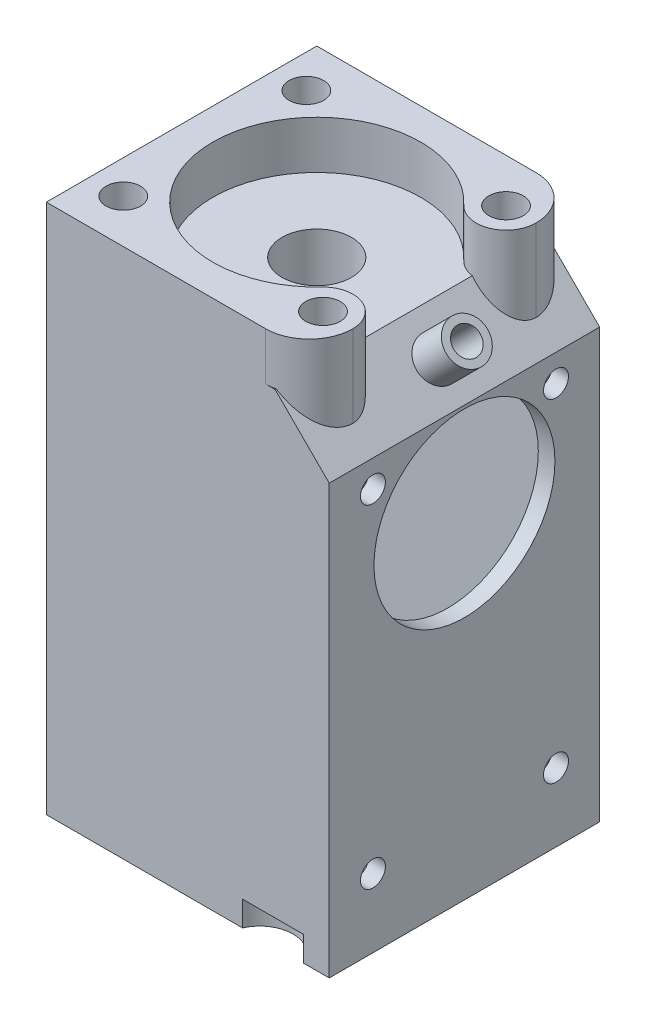
from build123d import *

# Parameters (mm, degrees)
SKETCH1_W           = 28.5
SKETCH1_H           = 46.5
SKETCH1_R           = 1.5
SKETCH1_R_2         = 10.875
BOSS_EXTRUDE1_DEPTH = 1
SKETCH2_W           = 34
SKETCH2_H           = 28.5
BOSS_EXTRUDE2_DEPTH = 6.5
CUT_EXTRUDE1_REACH  = 66.04
SKETCH4_R           = 4.175
SKETCH15_W          = 34
SKETCH15_H          = 28.5
SKETCH15_R          = 2.15
BOSS_EXTRUDE8_DEPTH = 5
CHAMFER1_SIZE       = 6.5
BOSS_EXTRUDE9_DEPTH = 2
SKETCH5_R           = 2.5
BOSS_EXTRUDE4_DEPTH = 5
CUT_EXTRUDE4_START  = -5
SKETCH7_R           = 1.6
CUT_EXTRUDE4_DEPTH  = 5
SKETCH10_R          = 2.075
BOSS_EXTRUDE6_DEPTH = 12.25
CUT_EXTRUDE7_START  = -10
SKETCH18_R          = 2.075
CUT_EXTRUDE7_DEPTH  = 10
SKETCH19_R          = 4
CUT_EXTRUDE8_DEPTH  = 3


with BuildPart() as part:
    # Sketch1 → Boss-Extrude1 (new, symmetric)
    with BuildSketch(Plane(origin=(0, 0, 0), x_dir=(0, 0, -1), z_dir=(1, 0, 0))):
        Rectangle(SKETCH1_W, SKETCH1_H)
        with Locations((-11, 20)):
            Circle(SKETCH1_R, mode=Mode.SUBTRACT)
        with Locations(Location((11, 20, 0), (0, 0, 180))):
            Circle(SKETCH1_R, mode=Mode.SUBTRACT)
        with Locations((11, -20)):
            Circle(SKETCH1_R, mode=Mode.SUBTRACT)
        with Locations(Location((-11, -20, 0), (0, 0, 180))):
            Circle(SKETCH1_R, mode=Mode.SUBTRACT)
        with Locations((0, 12)):
            Circle(SKETCH1_R_2, mode=Mode.SUBTRACT)
    extrude(amount=BOSS_EXTRUDE1_DEPTH, both=True)

    # Sketch2 → Boss-Extrude2 (add)
    with BuildSketch(Plane(origin=(0, 23.25, 0), x_dir=(1, 0, 0), z_dir=(0, 1, 0))):
        with Locations((-16, 0)):
            Rectangle(SKETCH2_W, SKETCH2_H)
    extrude(amount=BOSS_EXTRUDE2_DEPTH)

    # Sketch4 → Cut-Extrude1 (cut, up to next)
    with BuildSketch(Plane(origin=(0, 29.75, 0), x_dir=(1, 0, 0), z_dir=(0, 1, 0)), mode=Mode.PRIVATE) as cut_extrude1_sk1:
        with Locations(Location((-16.75, 0, 0), (0, 0, 270))):
            Circle(SKETCH4_R)
    cut_extrude1_tool1 = extrude(cut_extrude1_sk1.sketch, amount=-CUT_EXTRUDE1_REACH, mode=Mode.PRIVATE) & part.part
    add(cut_extrude1_tool1.solids().sort_by_distance((-16.75, 29.75, 0))[0], mode=Mode.SUBTRACT)

    # Sketch15 → Boss-Extrude8 (add)
    with BuildSketch(Plane.XZ.offset(23.25)):
        with Locations((-16, 0)):
            Rectangle(SKETCH15_W, SKETCH15_H)
        with Locations(Location((-12.75, 0, 0), (0, 0, 270))):
            Circle(SKETCH15_R, mode=Mode.SUBTRACT)
    extrude(amount=BOSS_EXTRUDE8_DEPTH)

    # Chamfer1
    chamfer1_edges = [part.edges().sort_by_distance(p)[0] for p in [
        (1, 29.75, 0),
    ]]
    chamfer(chamfer1_edges, length=CHAMFER1_SIZE)

    # Sketch17 → Boss-Extrude9 (add)
    with BuildSketch(Plane.XY.offset(14.25)):
        Polygon((-33, 29.75), (-33, -28.25), (1, -28.25), (1, 23.25), (-5.5, 29.75), align=None)
    boss_extrude9 = extrude(amount=BOSS_EXTRUDE9_DEPTH)

    # Mirror3: Boss-Extrude9 across plane
    add(boss_extrude9.mirror(Plane.XY))

    # Sketch5 → Boss-Extrude4 (add)
    with BuildSketch(Plane(origin=(12.125, 12.125, 0), x_dir=(0, 0, -1), z_dir=(0.7071067811865487, 0.7071067811865464, 0))):
        with Locations(Location((0, 20.329319959, 0), (0, 0, 90))):
            Circle(SKETCH5_R)
    extrude(amount=BOSS_EXTRUDE4_DEPTH)

    # Sketch7 → Cut-Extrude4 (cut)
    with BuildSketch(Plane(origin=(15.660533906, 15.660533906, 0), x_dir=(0, 0, -1), z_dir=(0.7071067811865487, 0.7071067811865464, 0)).offset(CUT_EXTRUDE4_START)):
        with Locations(Location((0, 20.329319959, 0), (0, 0, 90))):
            Circle(SKETCH7_R)
    extrude(amount=CUT_EXTRUDE4_DEPTH, mode=Mode.SUBTRACT)

    # Sketch10 → Boss-Extrude6 (add)
    with BuildSketch(Plane(origin=(0, 23.25, 0), x_dir=(1, 0, 0), z_dir=(0, 1, 0))):
        with BuildLine():
            Line((-33, -16.25), (-33, 16.25))
            Line((-33, 16.25), (-6.654581397, 16.25))
            ThreePointArc((-6.654581397, 16.25), (-2.942270796, 14.712310601), (-1.404581397, 11))
            ThreePointArc((-1.404581397, 11), (-3.679011202, 7.656046722), (-7.624732517, 8.542803601))
            ThreePointArc((-7.624732517, 8.542803601), (-29.25, 0), (-7.624732517, -8.542803601))
            ThreePointArc((-7.624732517, -8.542803601), (-3.679011202, -7.656046722), (-1.404581397, -11))
            ThreePointArc((-1.404581397, -11), (-2.942270796, -14.712310601), (-6.654581397, -16.25))
            Line((-6.654581397, -16.25), (-33, -16.25))
        make_face()
        with Locations(Location((-29, 11, 0), (0, 0, 90))):
            Circle(SKETCH10_R, mode=Mode.SUBTRACT)
        with Locations(Location((-29, -11, 0), (0, 0, 90))):
            Circle(SKETCH10_R, mode=Mode.SUBTRACT)
        with Locations(Location((-5, 11, 0), (0, 0, 103.943434861))):
            Circle(SKETCH10_R, mode=Mode.SUBTRACT)
        with Locations(Location((-5, -11, 0), (0, 0, 103.943434861))):
            Circle(SKETCH10_R, mode=Mode.SUBTRACT)
    extrude(amount=BOSS_EXTRUDE6_DEPTH)

    # Sketch18 → Cut-Extrude7 (cut)
    with BuildSketch(Plane(origin=(0, 35.5, 0), x_dir=(1, 0, 0), z_dir=(0, 1, 0)).offset(CUT_EXTRUDE7_START)):
        with Locations(Location((-5, -11, 0), (0, 0, 270))):
            Circle(SKETCH18_R)
        with Locations(Location((-5, 11, 0), (0, 0, 270))):
            Circle(SKETCH18_R)
    extrude(amount=CUT_EXTRUDE7_DEPTH, mode=Mode.SUBTRACT)

    # Sketch19 → Cut-Extrude8 (cut)
    with BuildSketch(Plane.XZ.offset(28.25)):
        with Locations((-5.75, 17.85)):
            Circle(SKETCH19_R)
        with Locations((-5.75, -17.85)):
            Circle(SKETCH19_R)
        with Locations(Location((-27.35, 8.14, 0), (0, 0, 270))):
            Circle(SKETCH19_R)
        with Locations(Location((-27.35, -8.14, 0), (0, 0, 270))):
            Circle(SKETCH19_R)
    extrude(amount=-CUT_EXTRUDE8_DEPTH, mode=Mode.SUBTRACT)


solid = part.part
